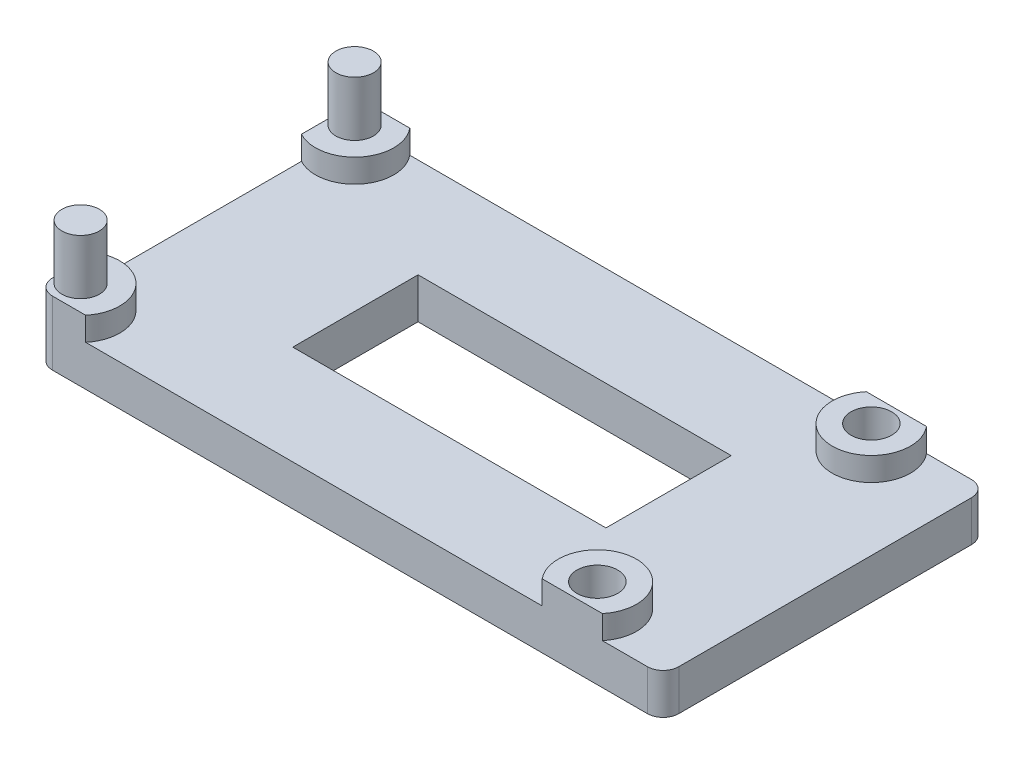
from build123d import *

# Parameters (mm, degrees)
SKETCH1_W           = 40
SKETCH1_H           = 20.7
BOSS_EXTRUDE1_DEPTH = 4.1
SKETCH2_R           = 1.2
BOSS_EXTRUDE2_DEPTH = 3.5
SKETCH3_R           = 1.3
CUT_EXTRUDE1_DEPTH  = 23.889571861
FILLET1_R           = 1
SKETCH4_W           = 48.8996316
SKETCH4_H           = 28.322761229
SKETCH4_R           = 2.5
CUT_EXTRUDE2_DEPTH  = 1.5
SKETCH5_W           = 20
SKETCH5_H           = 8
CUT_EXTRUDE3_DEPTH  = 24.067780561


with BuildPart() as part:
    # Sketch1 → Boss-Extrude1 (new body)
    with BuildSketch(Plane(origin=(0, 0, 0), x_dir=(1, 0, 0), z_dir=(0, 1, 0))):
        Rectangle(SKETCH1_W, SKETCH1_H)
    extrude(amount=BOSS_EXTRUDE1_DEPTH)

    # Sketch2 → Boss-Extrude2 (add)
    with BuildSketch(Plane(origin=(0, 4.1, 0), x_dir=(1, 0, 0), z_dir=(0, 1, 0))):
        with Locations(Location((-18.8, 8.75, 0), (0, 0, 180))):
            Circle(SKETCH2_R)
        with Locations(Location((-18.8, -8.75, 0), (0, 0, 180))):
            Circle(SKETCH2_R)
    extrude(amount=BOSS_EXTRUDE2_DEPTH)

    # Sketch3 → Cut-Extrude1 (cut, through all)
    with BuildSketch(Plane(origin=(0, 4.1, 0), x_dir=(1, 0, 0), z_dir=(0, 1, 0))):
        with Locations(Location((14.2, 8.75, 0), (0, 0, 270))):
            Circle(SKETCH3_R)
        with Locations(Location((14.2, -8.75, 0), (0, 0, 270))):
            Circle(SKETCH3_R)
    extrude(amount=-CUT_EXTRUDE1_DEPTH, mode=Mode.SUBTRACT)

    # Fillet1
    fillet1_edges = [part.edges().sort_by_distance(p)[0] for p in [
        (20, 2.05, 10.35),
        (-20, 2.05, 10.35),
        (-20, 2.05, -10.35),
        (20, 2.05, -10.35),
    ]]
    fillet(fillet1_edges, radius=FILLET1_R)

    # Sketch4 → Cut-Extrude2 (cut)
    with BuildSketch(Plane(origin=(0, 4.1, 0), x_dir=(1, 0, 0), z_dir=(0, 1, 0))):
        with Locations((0.354773627, -0.266080221)):
            Rectangle(SKETCH4_W, SKETCH4_H)
        with Locations((-18.8, 8.75)):
            Circle(SKETCH4_R, mode=Mode.SUBTRACT)
        with Locations((-18.8, -8.75)):
            Circle(SKETCH4_R, mode=Mode.SUBTRACT)
        with Locations((14.2, -8.75)):
            Circle(SKETCH4_R, mode=Mode.SUBTRACT)
        with Locations((14.2, 8.75)):
            Circle(SKETCH4_R, mode=Mode.SUBTRACT)
    extrude(amount=-CUT_EXTRUDE2_DEPTH, mode=Mode.SUBTRACT)

    # Sketch5 → Cut-Extrude3 (cut, through all)
    with BuildSketch(Plane(origin=(0, 2.6, 0), x_dir=(1, 0, 0), z_dir=(0, 1, 0))):
        Rectangle(SKETCH5_W, SKETCH5_H)
    extrude(amount=-CUT_EXTRUDE3_DEPTH, mode=Mode.SUBTRACT)


solid = part.part
